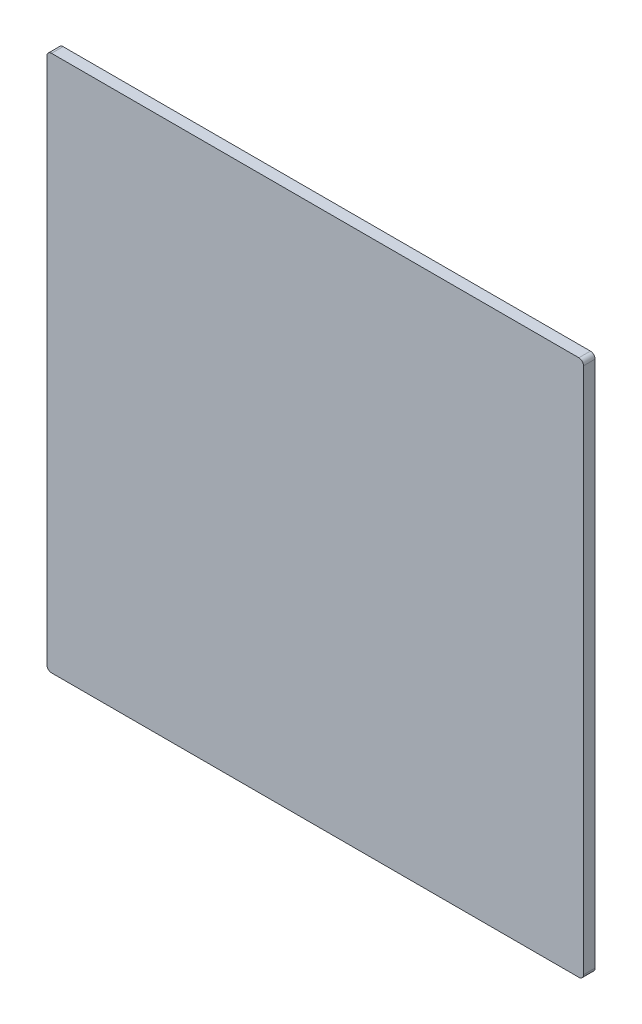
from build123d import *

# Parameters (mm, degrees)
SKETCH1_W           = 294.64
SKETCH1_H           = 294.64
BOSS_EXTRUDE1_DEPTH = 6.35
FILLET1_R           = 2.54


with BuildPart() as part:
    # Sketch1 → Boss-Extrude1 (new body)
    with BuildSketch(Plane.XY):
        with Locations((147.32, 147.32)):
            Rectangle(SKETCH1_W, SKETCH1_H)
    extrude(amount=BOSS_EXTRUDE1_DEPTH)

    # Fillet1
    fillet1_edges = [part.edges().sort_by_distance(p)[0] for p in [
        (0, 294.64, 3.175),
        (294.64, 294.64, 3.175),
        (294.64, 0, 3.175),
        (0, 0, 3.175),
    ]]
    fillet(fillet1_edges, radius=FILLET1_R)


solid = part.part
